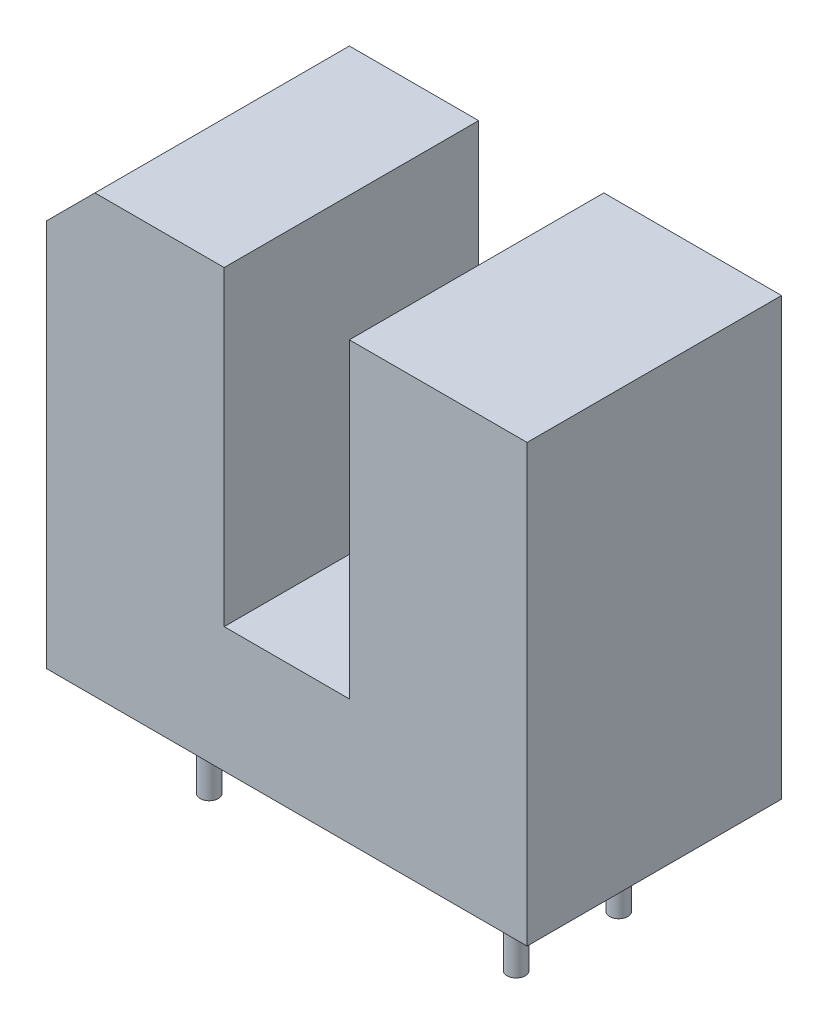
from build123d import *

# Parameters (mm, degrees)
SKETCH1_W           = 11.9
SKETCH1_H           = 6.3
BOSS_EXTRUDE1_DEPTH = 3.1
SKETCH2_W           = 4.4
SKETCH2_H           = 6.3
BOSS_EXTRUDE2_DEPTH = 7.7
SKETCH3_R           = 0.5
CUT_EXTRUDE1_DEPTH  = 1
CHAMFER1_SIZE       = 1.2
SKETCH4_R           = 0.225
BOSS_EXTRUDE3_DEPTH = 2.54


with BuildPart() as part:
    # Sketch1 → Boss-Extrude1 (new body)
    with BuildSketch(Plane(origin=(0, 0, 0), x_dir=(1, 0, 0), z_dir=(0, 1, 0))):
        Rectangle(SKETCH1_W, SKETCH1_H)
    extrude(amount=BOSS_EXTRUDE1_DEPTH)

    # Sketch2 → Boss-Extrude2 (add)
    with BuildSketch(Plane(origin=(0, 3.1, 0), x_dir=(1, 0, 0), z_dir=(0, 1, 0))):
        with Locations((-3.75, 0)):
            Rectangle(SKETCH2_W, SKETCH2_H)
        with Locations((3.75, 0)):
            Rectangle(SKETCH2_W, SKETCH2_H)
    extrude(amount=BOSS_EXTRUDE2_DEPTH)

    # Sketch3 → Cut-Extrude1 (cut)
    with BuildSketch(Plane.ZY.offset(-1.55)):
        with Locations((0, 8.2)):
            Circle(SKETCH3_R)
    extrude(amount=-CUT_EXTRUDE1_DEPTH, mode=Mode.SUBTRACT)

    # Chamfer1
    chamfer1_edges = [part.edges().sort_by_distance(p)[0] for p in [
        (-5.95, 10.8, 0),
    ]]
    chamfer(chamfer1_edges, length=CHAMFER1_SIZE)

    # Sketch4 → Boss-Extrude3 (add)
    with BuildSketch(Plane.XZ):
        with Locations(Location((-3.8, 1.27, 0), (0, 0, 90))):
            Circle(SKETCH4_R)
        with Locations(Location((-3.8, -1.27, 0), (0, 0, 90))):
            Circle(SKETCH4_R)
        with Locations(Location((3.8, 1.27, 0), (0, 0, 90))):
            Circle(SKETCH4_R)
        with Locations(Location((3.8, -1.27, 0), (0, 0, 90))):
            Circle(SKETCH4_R)
    extrude(amount=BOSS_EXTRUDE3_DEPTH)


solid = part.part
